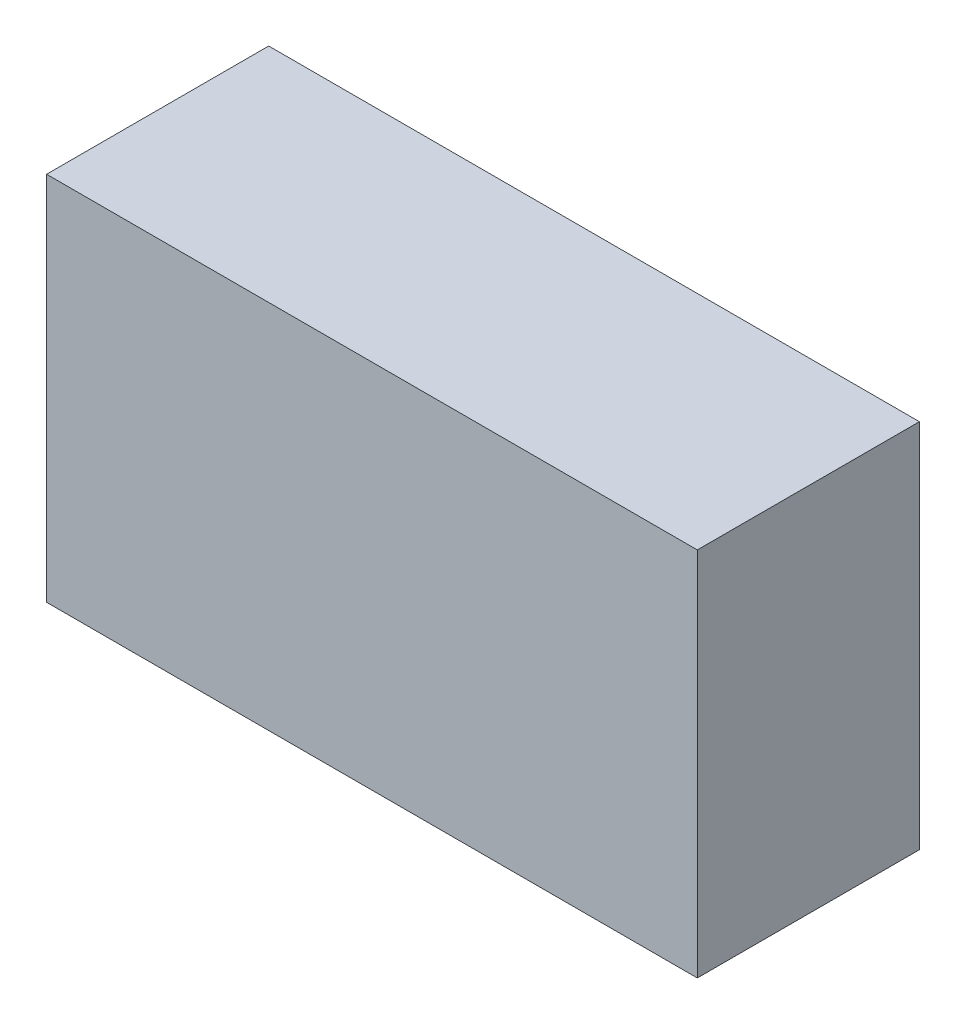
from build123d import *

# Parameters (mm, degrees)
SKETCH1_W                 = 21.24
SKETCH1_H                 = 12.101430126
BOSS_EXTRUDE1_DEPTH       = 7.25
SHELL1_T                  = -0.5
SHELL1_THICKNESS_2_FACE_W = 20.24
SHELL1_THICKNESS_2_FACE_H = 11.101430126
SHELL1_THICKNESS_2_DEPTH  = 0.3


with BuildPart() as part:
    # Sketch1 → Boss-Extrude1 (new body)
    with BuildSketch(Plane.XY):
        with Locations((-30.7955, 71.520715063)):
            Rectangle(SKETCH1_W, SKETCH1_H)
    extrude(amount=BOSS_EXTRUDE1_DEPTH)

    # Shell1
    shell1_openings = [part.faces().sort_by_distance(p)[0] for p in [
        (-30.7955, 71.520715063, 0),
    ]]
    offset(amount=SHELL1_T, openings=shell1_openings, kind=Kind.INTERSECTION)

    # Shell1 thickness 2 face (on inner face of the shell) → Shell1 thickness 2 (cut)
    with BuildSketch(Plane(origin=(-30.7955, 71.520715063, 6.75), x_dir=(1, 0, 0), z_dir=(0, 0, 1))):
        Rectangle(SHELL1_THICKNESS_2_FACE_W, SHELL1_THICKNESS_2_FACE_H)
    extrude(amount=SHELL1_THICKNESS_2_DEPTH, mode=Mode.SUBTRACT)


solid = part.part
